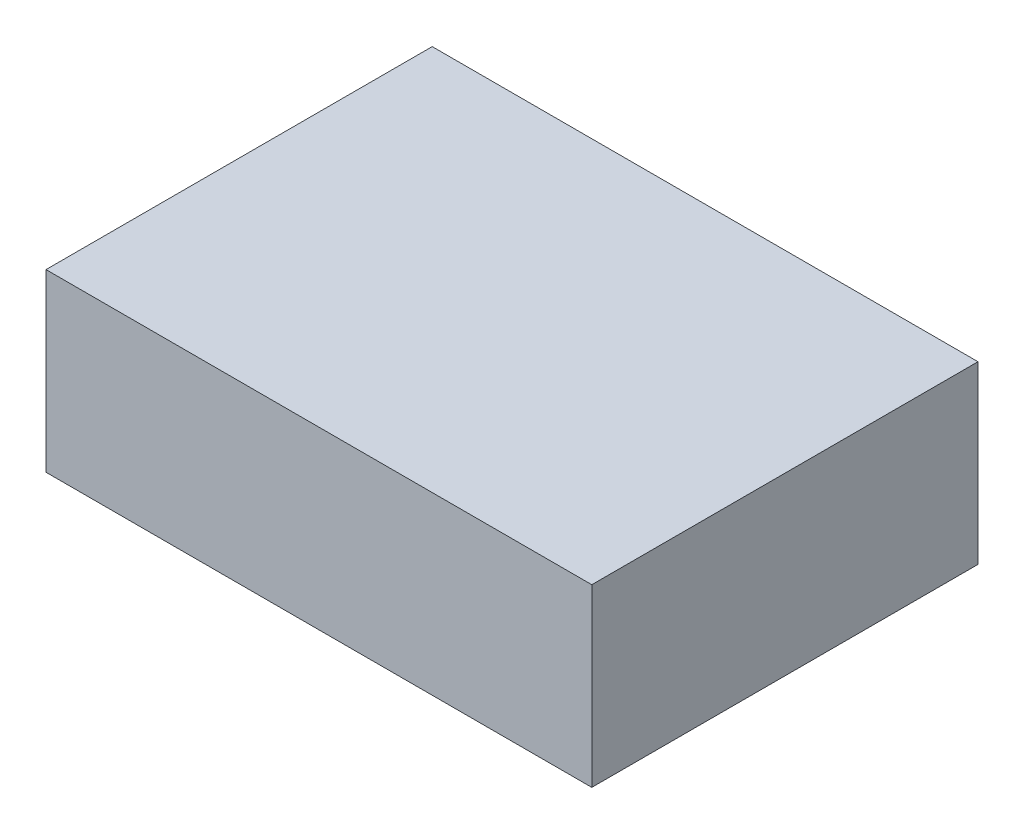
from build123d import *

# Parameters (mm, degrees)
SKETCH1_W           = 171
SKETCH1_H           = 121
BOSS_EXTRUDE1_DEPTH = 55


with BuildPart() as part:
    # Sketch1 → Boss-Extrude1 (new body)
    with BuildSketch(Plane(origin=(0, 0, 0), x_dir=(1, 0, 0), z_dir=(0, 1, 0))):
        Rectangle(SKETCH1_W, SKETCH1_H)
    extrude(amount=BOSS_EXTRUDE1_DEPTH)


solid = part.part
